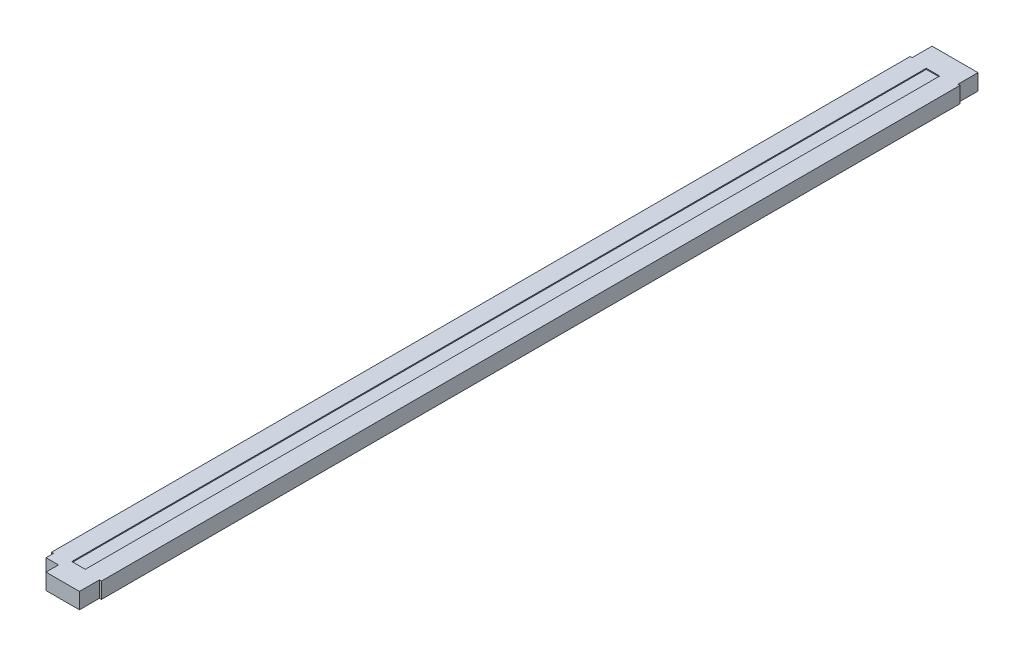
from build123d import *

# Parameters (mm, degrees)
SKETCH1_W               = 12.7
SKETCH1_H               = 4.064
BOSS_EXTRUDE1_DEPTH     = 228.6
SKETCH2_W               = 3.429
SKETCH2_H               = 217.3732
CUT_EXTRUDE1_DEPTH      = 0.254
SKETCH3_W               = 0.508
SKETCH3_H               = 5.08
CUT_EXTRUDE2_DEPTH      = 229.724285103
MIRROR2_COPY_1_SKETCH_W = 0.508
MIRROR2_COPY_1_SKETCH_H = 5.08
MIRROR2_COPY_1_DEPTH    = 229.724285103
SKETCH4_W               = 3.175
SKETCH4_H               = 3.175
CUT_EXTRUDE3_DEPTH      = 229.724285103


with BuildPart() as part:
    # Sketch1 → Boss-Extrude1 (new body)
    with BuildSketch(Plane.XY):
        Rectangle(SKETCH1_W, SKETCH1_H)
    extrude(amount=BOSS_EXTRUDE1_DEPTH)

    # Sketch2 → Cut-Extrude1 (cut)
    with BuildSketch(Plane(origin=(0, 2.032, 0), x_dir=(1, 0, 0), z_dir=(0, 1, 0))):
        with Locations((0, -114.3)):
            Rectangle(SKETCH2_W, SKETCH2_H)
    extrude(amount=-CUT_EXTRUDE1_DEPTH, mode=Mode.SUBTRACT)

    # Sketch3 → Cut-Extrude2 (cut, through all)
    with BuildSketch(Plane(origin=(0, 2.032, 0), x_dir=(1, 0, 0), z_dir=(0, 1, 0))):
        with Locations((-6.096, -226.06)):
            Rectangle(SKETCH3_W, SKETCH3_H)
    cut_extrude2 = extrude(amount=-CUT_EXTRUDE2_DEPTH, mode=Mode.SUBTRACT)

    # Mirror1: Cut-Extrude2 across plane
    add(cut_extrude2.mirror(Plane(origin=(0, 0, 114.3), x_dir=(1, 0, 0), z_dir=(0, 0, -1))), mode=Mode.SUBTRACT)

    # Mirror2: Cut-Extrude2 across plane
    add(cut_extrude2.mirror(Plane(origin=(0, 0, 0), x_dir=(0, 0, 1), z_dir=(1, 0, 0))), mode=Mode.SUBTRACT)

    # Mirror2 copy 1 sketch → Mirror2 copy 1 (cut, through all)
    with BuildSketch(Plane(origin=(0, 2.032, 228.6), x_dir=(-1, 0, 0), z_dir=(0, 1, 0))):
        with Locations((-6.096, -226.06)):
            Rectangle(MIRROR2_COPY_1_SKETCH_W, MIRROR2_COPY_1_SKETCH_H)
    extrude(amount=-MIRROR2_COPY_1_DEPTH, mode=Mode.SUBTRACT)

    # Sketch4 → Cut-Extrude3 (cut, through all)
    with BuildSketch(Plane(origin=(0, 2.032, 0), x_dir=(1, 0, 0), z_dir=(0, 1, 0))):
        with Locations((-4.2545, -227.0125)):
            Rectangle(SKETCH4_W, SKETCH4_H)
    extrude(amount=-CUT_EXTRUDE3_DEPTH, mode=Mode.SUBTRACT)


solid = part.part
